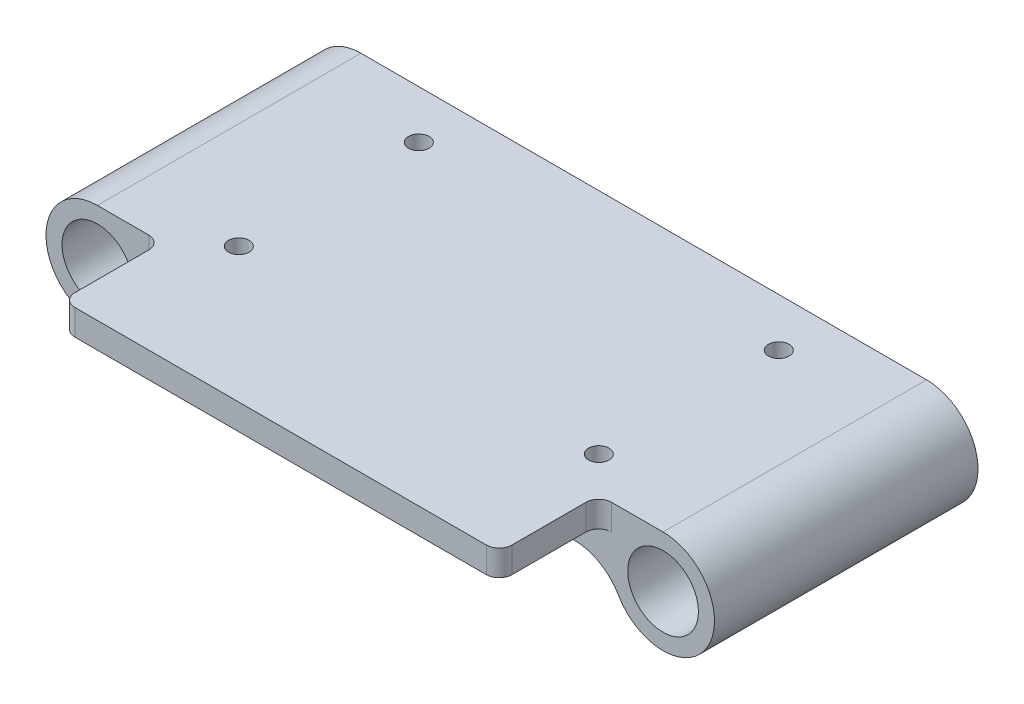
from build123d import *

# Parameters (mm, degrees)
BOSS_EXTRUDE1_DEPTH   = 10.25
FILLET1_R             = 4
BOSS_EXTRUDE2_DEPTH   = 2
M5_CLEARANCE_HOLE1_D  = 5.5
M2X0_4_TAPPED_HOLE1_D = 1.6
FILLET2_R             = 1


with BuildPart() as part:
    # Sketch1 → Boss-Extrude1 (new, symmetric)
    with BuildSketch(Plane.XY):
        with BuildLine():
            Line((22, 4), (-22, 4))
            ThreePointArc((-22, 4), (-24.828427125, -2.828427125), (-18, 0))
            Line((-18, 0), (18, 0))
            ThreePointArc((18, 0), (24.828427125, -2.828427125), (22, 4))
        make_face()
    extrude(amount=BOSS_EXTRUDE1_DEPTH, both=True)

    # Fillet1
    fillet1_edges = [part.edges().sort_by_distance(p)[0] for p in [
        (18, 0, 0),
        (-18, 0, 0),
    ]]
    fillet(fillet1_edges, radius=FILLET1_R)

    # Sketch7 → Boss-Extrude2 (add)
    with BuildSketch(Plane.XZ.offset(-2)):
        Polygon((17, 10.25), (17, 18), (-17, 18), (-17, 10.25), (-15.07179677, 10.25), (15.07179677, 10.25), align=None)
    extrude(amount=-BOSS_EXTRUDE2_DEPTH)

    # M5 Clearance Hole1 (through all)
    with Locations(Plane.XY.offset(10.25)):
        with Locations((-22, 0), (22, 0)):
            Hole(M5_CLEARANCE_HOLE1_D / 2)

    # M2x0.4 Tapped Hole1 (through all)
    with Locations(Plane(origin=(0, 4, 0), x_dir=(1, 0, 0), z_dir=(0, 1, 0))):
        with Locations((14.25, 6.500000018), (14.25, -7.499999982), (-13.75, -7.499999982), (-13.75, 6.500000018)):
            Hole(M2X0_4_TAPPED_HOLE1_D / 2)

    # Fillet2
    fillet2_edges = [part.edges().sort_by_distance(p)[0] for p in [
        (17, 3, 18),
        (17, 3, 10.25),
        (-17, 3, 10.25),
        (-17, 3, 18),
    ]]
    fillet(fillet2_edges, radius=FILLET2_R)


solid = part.part
